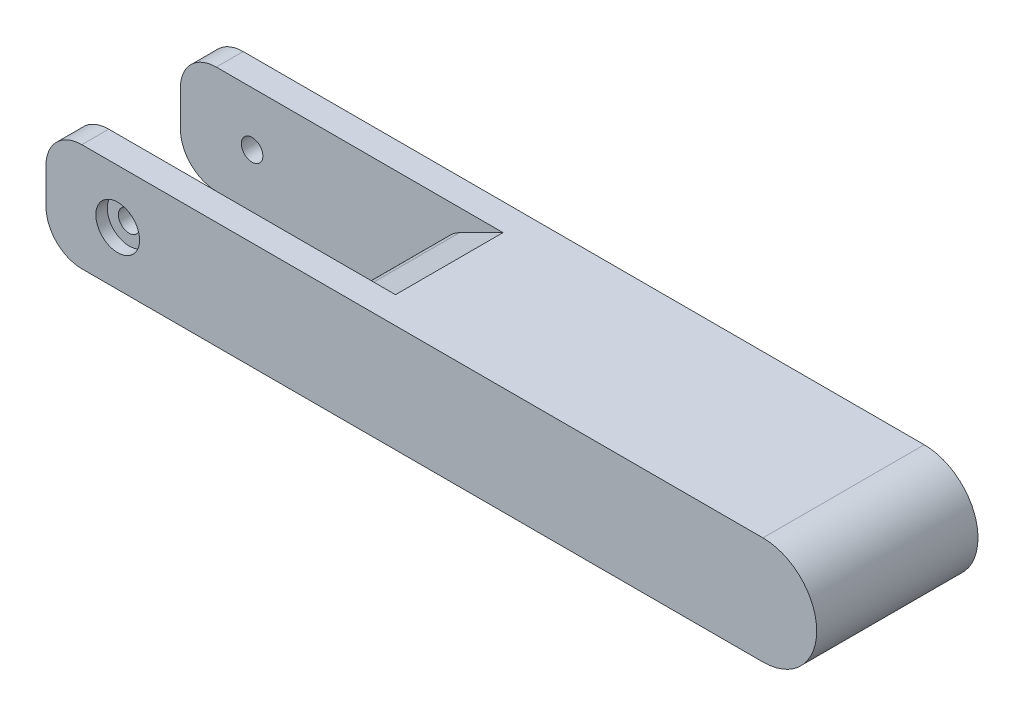
from build123d import *

# Parameters (mm, degrees)
SKETCH1_R           = 3
BOSS_EXTRUDE1_DEPTH = 22.5
SKETCH3_W           = 60
SKETCH3_H           = 30
CUT_EXTRUDE1_DEPTH  = 121.959704034
FILLET1_R           = 10
CUT_EXTRUDE2_DEPTH  = 30
CUT_EXTRUDE4_DEPTH  = 30
FILLET2_R           = 10
SKETCH6_R           = 6.1
CUT_EXTRUDE5_DEPTH  = 3.2
CUT_EXTRUDE6_START  = -3.2
SKETCH7_R           = 6.1
CUT_EXTRUDE6_DEPTH  = 3.2


with BuildPart() as part:
    # Sketch1 → Boss-Extrude1 (new, symmetric)
    with BuildSketch(Plane.XY):
        with BuildLine():
            Line((-100, -15), (100, -15))
            ThreePointArc((100, -15), (115, 0), (100, 15))
            Line((100, 15), (-100, 15))
            Line((-100, 15), (-100, -15))
        make_face()
        with Locations(Location((-80, 0, 0), (0, 0, 180))):
            Circle(SKETCH1_R, mode=Mode.SUBTRACT)
    extrude(amount=BOSS_EXTRUDE1_DEPTH, both=True)

    # Sketch3 → Cut-Extrude1 (cut, through all)
    with BuildSketch(Plane(origin=(0, 15, 0), x_dir=(1, 0, 0), z_dir=(0, 1, 0))):
        with Locations((-70, 0)):
            Rectangle(SKETCH3_W, SKETCH3_H)
    extrude(amount=-CUT_EXTRUDE1_DEPTH, mode=Mode.SUBTRACT)

    # Fillet1
    fillet1_edges = [part.edges().sort_by_distance(p)[0] for p in [
        (-100, -15, -18.75),
        (-100, 15, -18.75),
        (-100, -15, 18.75),
        (-100, 15, 18.75),
    ]]
    fillet(fillet1_edges, radius=FILLET1_R)

    # Sketch4 → Cut-Extrude2 (cut)
    with BuildSketch(Plane(origin=(0, 0, -15), x_dir=(-1, 0, 0), z_dir=(0, 0, -1))):
        Polygon((40, 15), (40, 0), (10, 15), align=None)
    extrude(amount=-CUT_EXTRUDE2_DEPTH, mode=Mode.SUBTRACT)

    # Sketch5 → Cut-Extrude4 (cut)
    with BuildSketch(Plane(origin=(0, 0, -15), x_dir=(-1, 0, 0), z_dir=(0, 0, -1))):
        Polygon((40, 0), (40, -15), (10, -15), align=None)
    extrude(amount=-CUT_EXTRUDE4_DEPTH, mode=Mode.SUBTRACT)

    # Fillet2
    fillet2_edges = [part.edges().sort_by_distance(p)[0] for p in [
        (-40, 0, 0),
    ]]
    fillet(fillet2_edges, radius=FILLET2_R)

    # Sketch6 → Cut-Extrude5 (cut)
    with BuildSketch(Plane.XY.offset(22.5)):
        with Locations((-80, 0)):
            Circle(SKETCH6_R)
    extrude(amount=-CUT_EXTRUDE5_DEPTH, mode=Mode.SUBTRACT)

    # Sketch7 → Cut-Extrude6 (cut)
    with BuildSketch(Plane(origin=(0, 0, -22.5), x_dir=(-1, 0, 0), z_dir=(0, 0, -1)).offset(CUT_EXTRUDE6_START)):
        with Locations(Location((80, 0, 0), (0, 0, 180))):
            Circle(SKETCH7_R)
    extrude(amount=CUT_EXTRUDE6_DEPTH, mode=Mode.SUBTRACT)


solid = part.part
